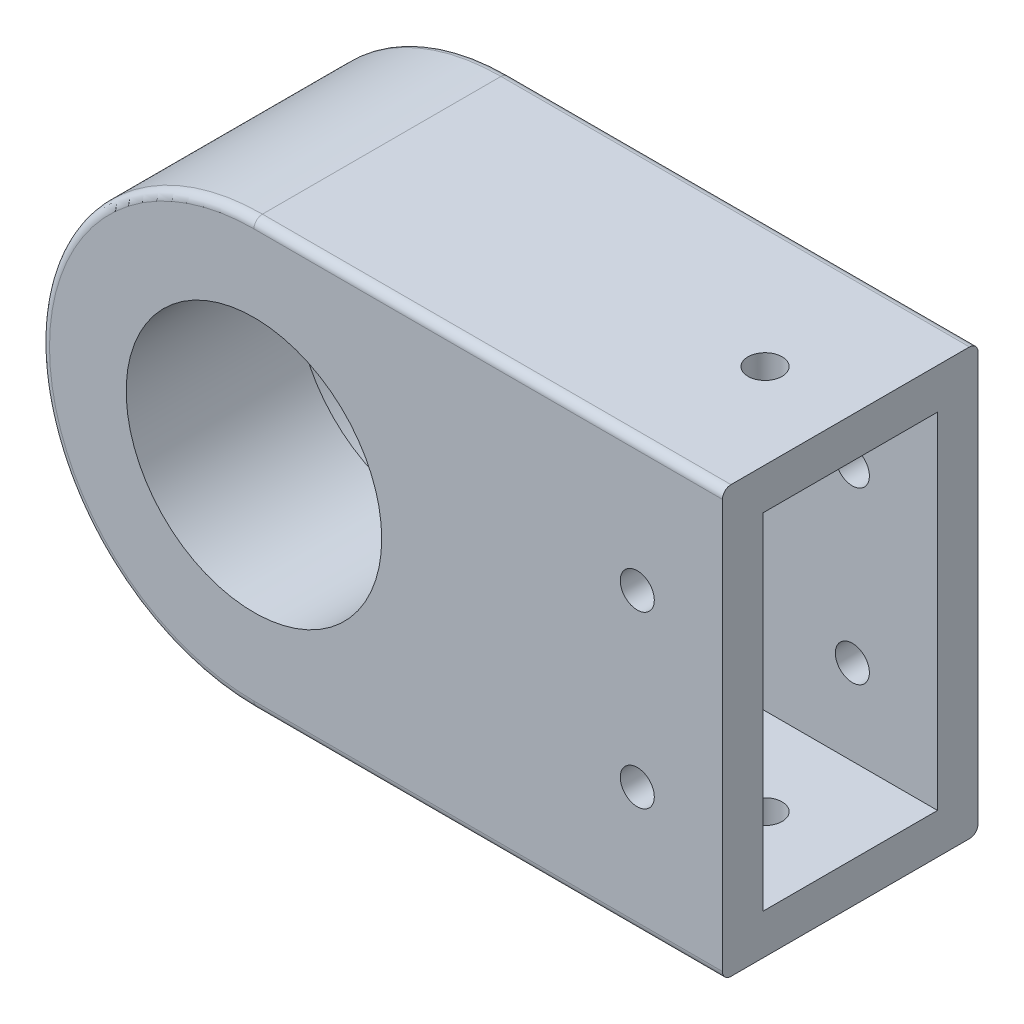
from build123d import *

# Parameters (mm, degrees)
BOSS_EXTRUDE2_DEPTH      = 30
SKETCH3_R                = 6.5
CUT_EXTRUDE2_DEPTH       = 40
SKETCH4_R                = 19
CUT_EXTRUDE3_DEPTH       = 25
SKETCH2_W                = 20.5
SKETCH2_H                = 40.5
CUT_EXTRUDE5_DEPTH       = 50
SKETCH6_R                = 6.75
CUT_EXTRUDE6_DEPTH       = 50
SKETCH7_R                = 19.25
CUT_EXTRUDE7_DEPTH       = 25
SKETCH8_W                = 30
SKETCH8_H                = 50
CUT_EXTRUDE8_DEPTH       = 15
CUT_EXTRUDE9_DEPTH       = 100
CUT_EXTRUDE9_DEPTH_BACK  = 15
SKETCH9_R                = 2
CUT_EXTRUDE10_DEPTH      = 100
CUT_EXTRUDE10_DEPTH_BACK = 15
SKETCH10_R               = 2
FILLET1_R                = 1
SKETCH12_R               = 6.75
SKETCH12_R_2             = 5
BOSS_EXTRUDE3_DEPTH      = 5
SKETCH13_R               = 1
CUT_EXTRUDE11_DEPTH      = 5
SKETCH14_R               = 19.25
SKETCH14_R_2             = 15
BOSS_EXTRUDE4_DEPTH      = 20


with BuildPart() as part:
    # Sketch1 → Boss-Extrude2 (new body)
    with BuildSketch(Plane.XY):
        with BuildLine():
            Line((0, 25), (70, 25))
            Line((70, 25), (70, -25))
            Line((70, -25), (0, -25))
            ThreePointArc((0, -25), (-25, 0), (0, 25))
        make_face()
    extrude(amount=BOSS_EXTRUDE2_DEPTH)

    # Sketch3 → Cut-Extrude2 (cut)
    with BuildSketch(Plane.XY.offset(30)):
        Circle(SKETCH3_R)
    extrude(amount=-CUT_EXTRUDE2_DEPTH, mode=Mode.SUBTRACT)

    # Sketch4 → Cut-Extrude3 (cut)
    with BuildSketch(Plane.XY.offset(30)):
        Circle(SKETCH4_R)
    extrude(amount=-CUT_EXTRUDE3_DEPTH, mode=Mode.SUBTRACT)

    # Sketch2 → Cut-Extrude5 (cut)
    with BuildSketch(Plane(origin=(70, 0, 0), x_dir=(0, 0, -1), z_dir=(1, 0, 0))):
        with Locations((-15, 0)):
            Rectangle(SKETCH2_W, SKETCH2_H)
    extrude(amount=-CUT_EXTRUDE5_DEPTH, mode=Mode.SUBTRACT)

    # Sketch6 → Cut-Extrude6 (cut)
    with BuildSketch(Plane.XY.offset(30)):
        Circle(SKETCH6_R)
    extrude(amount=-CUT_EXTRUDE6_DEPTH, mode=Mode.SUBTRACT)

    # Sketch7 → Cut-Extrude7 (cut)
    with BuildSketch(Plane.XY.offset(30)):
        Circle(SKETCH7_R)
    extrude(amount=-CUT_EXTRUDE7_DEPTH, mode=Mode.SUBTRACT)

    # Sketch8 → Cut-Extrude8 (cut)
    with BuildSketch(Plane(origin=(70, 0, 0), x_dir=(0, 0, -1), z_dir=(1, 0, 0))):
        with Locations((-15, 0)):
            Rectangle(SKETCH8_W, SKETCH8_H)
    extrude(amount=-CUT_EXTRUDE8_DEPTH, mode=Mode.SUBTRACT)

    # Sketch9 → Cut-Extrude9 (cut, two sides: drawn at the far end of the back side and taken through both)
    with BuildSketch(Plane.XY.offset(4.75).offset(-CUT_EXTRUDE9_DEPTH_BACK)):
        with Locations(Location((45, -10.25, 0), (0, 0, 180))):
            Circle(SKETCH9_R)
        with Locations(Location((45, 9.75, 0), (0, 0, 180))):
            Circle(SKETCH9_R)
    extrude(amount=CUT_EXTRUDE9_DEPTH + CUT_EXTRUDE9_DEPTH_BACK, mode=Mode.SUBTRACT)

    # Sketch10 → Cut-Extrude10 (cut, two sides: drawn at the far end of the back side and taken through both)
    with BuildSketch(Plane(origin=(0, -20.25, 0), x_dir=(1, 0, 0), z_dir=(0, 1, 0)).offset(-CUT_EXTRUDE10_DEPTH_BACK)):
        with Locations(Location((45, -15, 0), (0, 0, 90))):
            Circle(SKETCH10_R)
    extrude(amount=CUT_EXTRUDE10_DEPTH + CUT_EXTRUDE10_DEPTH_BACK, mode=Mode.SUBTRACT)

    # Fillet1
    fillet1_edges = [part.edges().sort_by_distance(p)[0] for p in [
        (-25, 0, 30),
        (27.5, -25, 0),
        (27.5, 25, 0),
        (27.5, 25, 30),
        (-25, 0, 0),
        (27.5, -25, 30),
    ]]
    fillet(fillet1_edges, radius=FILLET1_R)

    # Sketch12 → Boss-Extrude3 (add)
    with BuildSketch(Plane.XY.offset(5)):
        Circle(SKETCH12_R)
        Circle(SKETCH12_R_2, mode=Mode.SUBTRACT)
    extrude(amount=-BOSS_EXTRUDE3_DEPTH)

    # Sketch13 → Cut-Extrude11 (cut)
    with BuildSketch(Plane.XY.offset(5)):
        with Locations((-8, 0)):
            Circle(SKETCH13_R)
        with Locations((0, 8)):
            Circle(SKETCH13_R)
        with Locations((8, 0)):
            Circle(SKETCH13_R)
        with Locations((0, -8)):
            Circle(SKETCH13_R)
    extrude(amount=-CUT_EXTRUDE11_DEPTH, mode=Mode.SUBTRACT)

    # Sketch14 → Boss-Extrude4 (add)
    with BuildSketch(Plane.XY.offset(30)):
        Circle(SKETCH14_R)
        Circle(SKETCH14_R_2, mode=Mode.SUBTRACT)
    extrude(amount=-BOSS_EXTRUDE4_DEPTH)


solid = part.part
